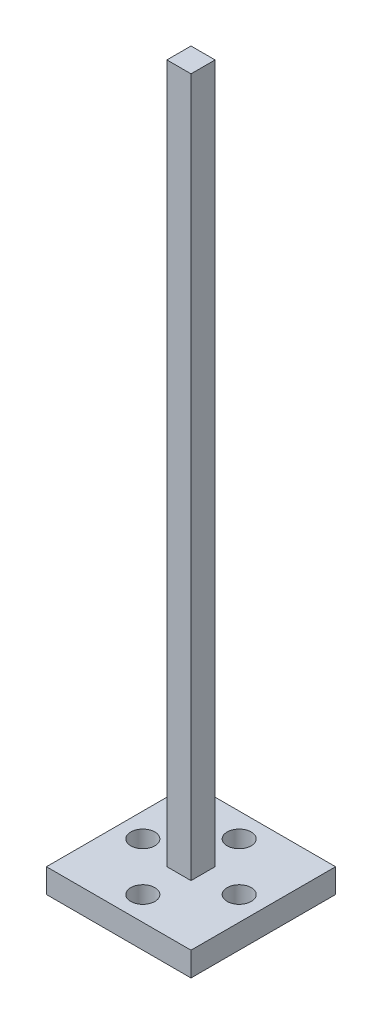
from build123d import *

# Parameters (mm, degrees)
SKETCH5_W           = 30
SKETCH5_H           = 30
BOSS_EXTRUDE1_DEPTH = 5
SKETCH5_3_W         = 5
SKETCH5_3_H         = 5
BOSS_EXTRUDE2_DEPTH = 150
CUT_EXTRUDE2_REACH  = 148.544
SKETCH6_R           = 2.5


with BuildPart() as part:
    # Sketch5 → Boss-Extrude1 (new body)
    with BuildSketch(Plane(origin=(0, 0, 0), x_dir=(1, 0, 0), z_dir=(0, 1, 0))):
        Rectangle(SKETCH5_W, SKETCH5_H)
    extrude(amount=BOSS_EXTRUDE1_DEPTH)

    # Sketch5<3> → Boss-Extrude2 (add)
    with BuildSketch(Plane(origin=(0, 0, 0), x_dir=(1, 0, 0), z_dir=(0, 1, 0))):
        Rectangle(SKETCH5_3_W, SKETCH5_3_H)
    extrude(amount=BOSS_EXTRUDE2_DEPTH)

    # Sketch6 → Cut-Extrude2 (cut, up to next)
    with BuildSketch(Plane(origin=(0, 5, 0), x_dir=(1, 0, 0), z_dir=(0, 1, 0)), mode=Mode.PRIVATE) as cut_extrude2_sk1:
        with Locations((0, 10)):
            Circle(SKETCH6_R)
    cut_extrude2_tool1 = extrude(cut_extrude2_sk1.sketch, amount=-CUT_EXTRUDE2_REACH, mode=Mode.PRIVATE) & part.part
    # Sketch6 → Cut-Extrude2 (cut, up to next)
    with BuildSketch(Plane(origin=(0, 5, 0), x_dir=(1, 0, 0), z_dir=(0, 1, 0)), mode=Mode.PRIVATE) as cut_extrude2_sk2:
        with Locations((10, 0)):
            Circle(SKETCH6_R)
    cut_extrude2_tool2 = extrude(cut_extrude2_sk2.sketch, amount=-CUT_EXTRUDE2_REACH, mode=Mode.PRIVATE) & part.part
    # Sketch6 → Cut-Extrude2 (cut, up to next)
    with BuildSketch(Plane(origin=(0, 5, 0), x_dir=(1, 0, 0), z_dir=(0, 1, 0)), mode=Mode.PRIVATE) as cut_extrude2_sk3:
        with Locations((0, -10)):
            Circle(SKETCH6_R)
    cut_extrude2_tool3 = extrude(cut_extrude2_sk3.sketch, amount=-CUT_EXTRUDE2_REACH, mode=Mode.PRIVATE) & part.part
    # Sketch6 → Cut-Extrude2 (cut, up to next)
    with BuildSketch(Plane(origin=(0, 5, 0), x_dir=(1, 0, 0), z_dir=(0, 1, 0)), mode=Mode.PRIVATE) as cut_extrude2_sk4:
        with Locations((-10, 0)):
            Circle(SKETCH6_R)
    cut_extrude2_tool4 = extrude(cut_extrude2_sk4.sketch, amount=-CUT_EXTRUDE2_REACH, mode=Mode.PRIVATE) & part.part
    add(cut_extrude2_tool1.solids().sort_by_distance((0, 5, -10))[0], mode=Mode.SUBTRACT)
    add(cut_extrude2_tool2.solids().sort_by_distance((10, 5, 0))[0], mode=Mode.SUBTRACT)
    add(cut_extrude2_tool3.solids().sort_by_distance((0, 5, 10))[0], mode=Mode.SUBTRACT)
    add(cut_extrude2_tool4.solids().sort_by_distance((-10, 5, 0))[0], mode=Mode.SUBTRACT)


solid = part.part
